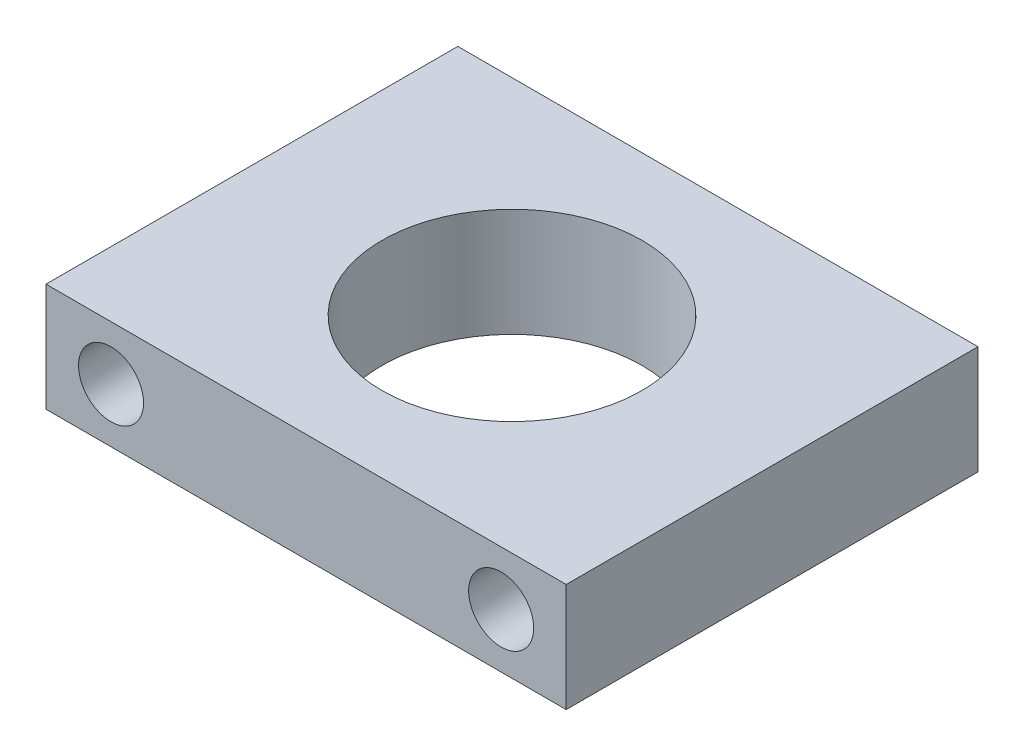
from build123d import *

# Parameters (mm, degrees)
SKETCH_1_W          = 24
SKETCH_1_H          = 19
EXTRUDE_1_DEPTH     = 5
CUT_EXTRUDE_1_REACH = 18.101
SKETCH_2_R          = 6
CUT_EXTRUDE_2_REACH = 25.022
SKETCH_3_R          = 1.5


with BuildPart() as part:
    # 草图1 → 凸台-拉伸1 (new body)
    with BuildSketch(Plane(origin=(0, 0, 0), x_dir=(1, 0, 0), z_dir=(0, 1, 0))):
        Rectangle(SKETCH_1_W, SKETCH_1_H)
    extrude(amount=EXTRUDE_1_DEPTH)

    # 草图2 → 切除-拉伸1 (cut, up to next)
    with BuildSketch(Plane(origin=(0, 5, 0), x_dir=(1, 0, 0), z_dir=(0, 1, 0)), mode=Mode.PRIVATE) as cut_extrude_1_sk1:
        with Locations(Location((0, 0, 0), (0, 0, 270))):
            Circle(SKETCH_2_R)
    cut_extrude_1_tool1 = extrude(cut_extrude_1_sk1.sketch, amount=-CUT_EXTRUDE_1_REACH, mode=Mode.PRIVATE) & part.part
    add(cut_extrude_1_tool1.solids().sort_by_distance((0, 5, 0))[0], mode=Mode.SUBTRACT)

    # 草图3 → 切除-拉伸2 (cut, up to next)
    with BuildSketch(Plane.XY.offset(9.5), mode=Mode.PRIVATE) as cut_extrude_2_sk1:
        with Locations((-9, 2.5)):
            Circle(SKETCH_3_R)
    cut_extrude_2_tool1 = extrude(cut_extrude_2_sk1.sketch, amount=-CUT_EXTRUDE_2_REACH, mode=Mode.PRIVATE) & part.part
    # 草图3 → 切除-拉伸2 (cut, up to next)
    with BuildSketch(Plane.XY.offset(9.5), mode=Mode.PRIVATE) as cut_extrude_2_sk2:
        with Locations((9, 2.5)):
            Circle(SKETCH_3_R)
    cut_extrude_2_tool2 = extrude(cut_extrude_2_sk2.sketch, amount=-CUT_EXTRUDE_2_REACH, mode=Mode.PRIVATE) & part.part
    add(cut_extrude_2_tool1.solids().sort_by_distance((-9, 2.5, 9.5))[0], mode=Mode.SUBTRACT)
    add(cut_extrude_2_tool2.solids().sort_by_distance((9, 2.5, 9.5))[0], mode=Mode.SUBTRACT)


solid = part.part
